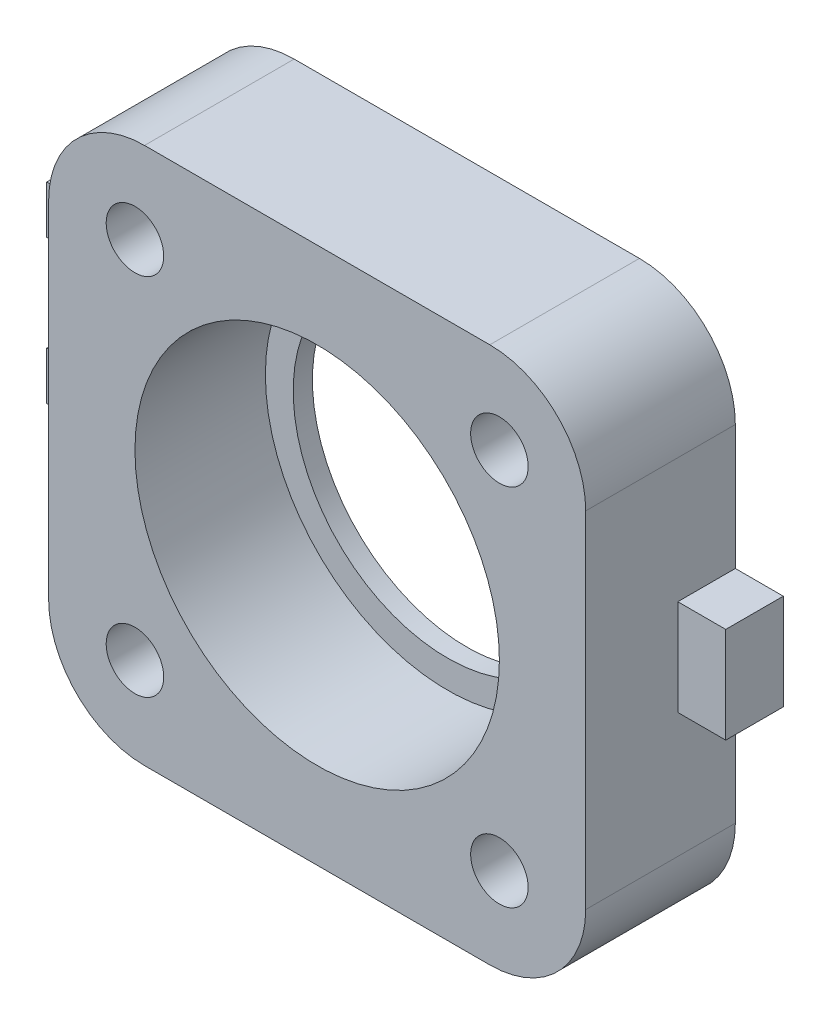
from build123d import *

# Parameters (mm, degrees)
CROQUIS1_W              = 28
CROQUIS1_H              = 28
CROQUIS1_R              = 8.05
SALIENTE_EXTRUIR1_DEPTH = 0.5
CROQUIS2_W              = 28
CROQUIS2_H              = 28
CROQUIS2_R              = 9.5
SALIENTE_EXTRUIR2_DEPTH = 6.8
CROQUIS7_W              = 2.5
CROQUIS7_H              = 5
CROQUIS7_W_2            = 10
CROQUIS7_H_2            = 4
SALIENTE_EXTRUIR3_DEPTH = 3
REDONDEO1_R             = 5
CROQUIS6_R              = 1.5
CORTAR_EXTRUIR3_DEPTH   = 10


with BuildPart() as part:
    # Croquis1 → Saliente-Extruir1 (new, symmetric)
    with BuildSketch(Plane.XY):
        Rectangle(CROQUIS1_W, CROQUIS1_H)
        Circle(CROQUIS1_R, mode=Mode.SUBTRACT)
    extrude(amount=SALIENTE_EXTRUIR1_DEPTH, both=True)

    # Croquis2 → Saliente-Extruir2 (add)
    with BuildSketch(Plane.XY.offset(0.5)):
        Rectangle(CROQUIS2_W, CROQUIS2_H)
        Circle(CROQUIS2_R, mode=Mode.SUBTRACT)
    extrude(amount=SALIENTE_EXTRUIR2_DEPTH)

    # Croquis7 → Saliente-Extruir3 (add)
    with BuildSketch(Plane(origin=(0, 0, -0.5), x_dir=(-1, 0, 0), z_dir=(0, 0, -1))):
        with Locations((-15.25, 0)):
            Rectangle(CROQUIS7_W, CROQUIS7_H)
        with Locations((0, -16)):
            Rectangle(CROQUIS7_W_2, CROQUIS7_H_2)
        Polygon((14, -2.5), (14, -5), (18.9, -5), (18.9, -2.5), (16.5, -2.5), align=None)
        with Locations((15.25, 0)):
            Rectangle(CROQUIS7_W, CROQUIS7_H)
        Polygon((14, 5), (14, 2.5), (16.5, 2.5), (18.9, 2.5), (18.9, 5), align=None)
    extrude(amount=-SALIENTE_EXTRUIR3_DEPTH)

    # Redondeo1
    redondeo1_edges = [part.edges().sort_by_distance(p)[0] for p in [
        (14, -14, 3.4),
        (-14, -14, 3.4),
        (-14, 14, 3.4),
        (14, 14, 3.4),
    ]]
    fillet(redondeo1_edges, radius=REDONDEO1_R)

    # Croquis6 → Cortar-Extruir3 (cut)
    with BuildSketch(Plane(origin=(0, 0, -0.5), x_dir=(-1, 0, 0), z_dir=(0, 0, -1))):
        with Locations((-9.5, 9.5)):
            Circle(CROQUIS6_R)
        with Locations((9.5, 9.5)):
            Circle(CROQUIS6_R)
        with Locations((9.5, -9.5)):
            Circle(CROQUIS6_R)
        with Locations((-9.5, -9.5)):
            Circle(CROQUIS6_R)
    extrude(amount=-CORTAR_EXTRUIR3_DEPTH, mode=Mode.SUBTRACT)


solid = part.part
